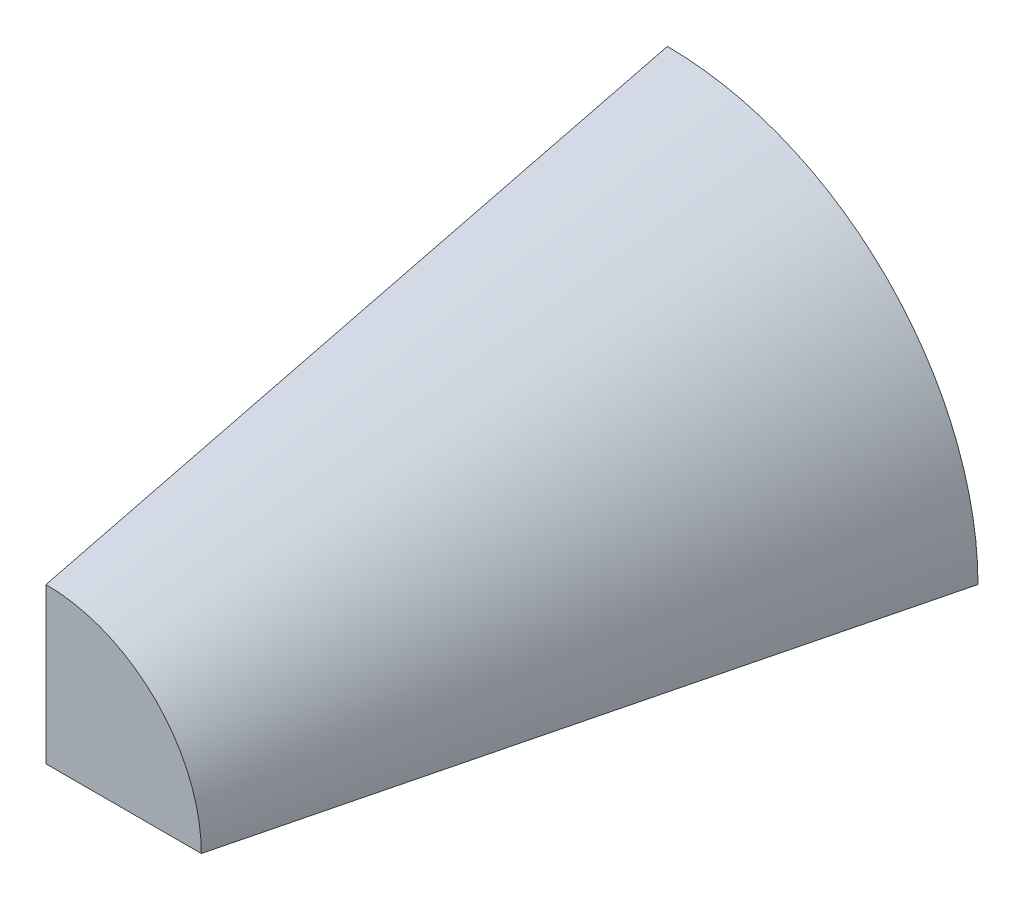
from build123d import *

# Parameters (mm, degrees)
FEATURE_FRUSTUM_ANGLE = 90


with BuildPart() as part:
    # sketch:main-profile → feature:frustum (revolve)
    with BuildSketch(Plane.XZ):
        Polygon((0, 0), (10, 0), (5, 20), (0, 20), align=None)
    revolve(axis=Axis((0, 0, -5), (0, 0, 1)), revolution_arc=FEATURE_FRUSTUM_ANGLE)


solid = part.part
